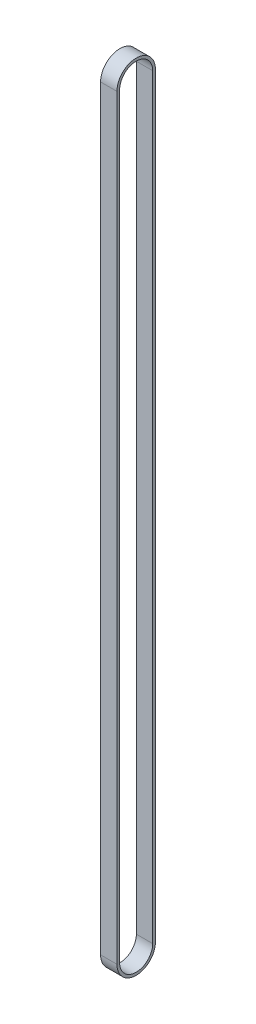
from build123d import *

# Parameters (mm, degrees)
BOSS_EXTRUDE1_DEPTH = 6.05


with BuildPart() as part:
    # Sketch1 → Boss-Extrude1 (new body)
    with BuildSketch(Plane.YZ):
        with BuildLine():
            Line((-140, 7.125), (140, 7.125))
            ThreePointArc((140, 7.125), (147.125, 0), (140, -7.125))
            Line((140, -7.125), (-140, -7.125))
            ThreePointArc((-140, -7.125), (-147.125, 0), (-140, 7.125))
        make_face()
        with BuildLine():
            Line((-140, 6.125), (140, 6.125))
            ThreePointArc((140, 6.125), (146.125, 0), (140, -6.125))
            Line((140, -6.125), (-140, -6.125))
            ThreePointArc((-140, -6.125), (-146.125, 0), (-140, 6.125))
        make_face(mode=Mode.SUBTRACT)
    extrude(amount=BOSS_EXTRUDE1_DEPTH)


solid = part.part
